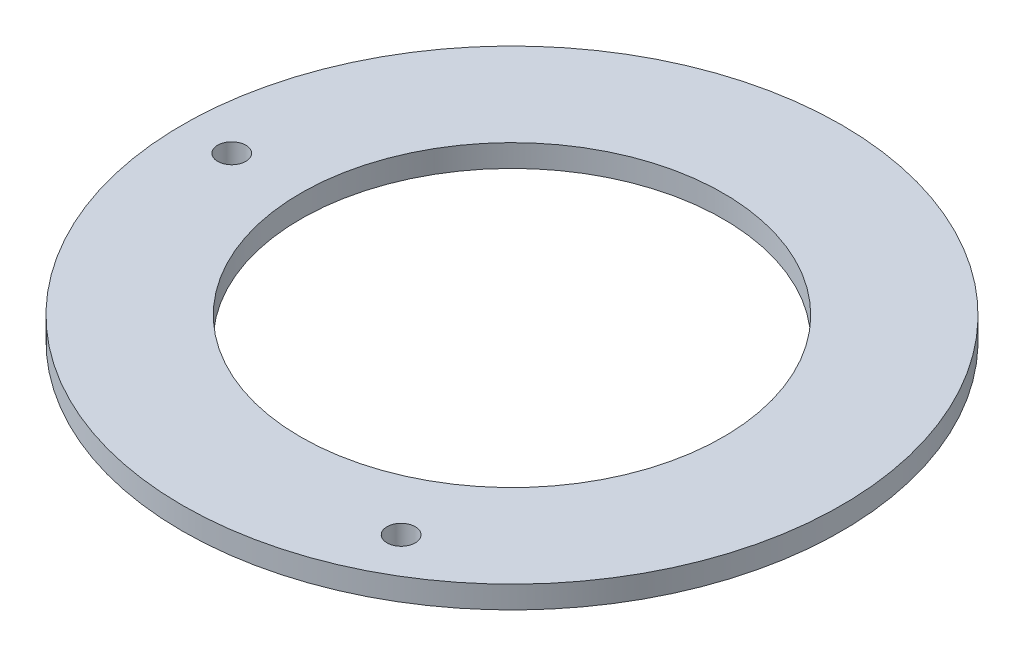
from build123d import *

# Parameters (mm, degrees)
SKETCH1_R           = 46.8
SKETCH1_R_2         = 30
SKETCH1_R_3         = 2
BOSS_EXTRUDE1_DEPTH = 3.175


with BuildPart() as part:
    # Sketch1 → Boss-Extrude1 (new body)
    with BuildSketch(Plane(origin=(0, 0, 0), x_dir=(1, 0, 0), z_dir=(0, 1, 0))):
        with Locations(Location((0, 0, 0), (0, 0, 270))):
            Circle(SKETCH1_R)
        with Locations(Location((0, 0, 0), (0, 0, 270))):
            Circle(SKETCH1_R_2, mode=Mode.SUBTRACT)
        with Locations(Location((-39.8, 0, 0), (0, 0, 270))):
            Circle(SKETCH1_R_3, mode=Mode.SUBTRACT)
        with Locations(Location((19.147864322, -34.891249504, 0), (0, 0, 270))):
            Circle(SKETCH1_R_3, mode=Mode.SUBTRACT)
    extrude(amount=BOSS_EXTRUDE1_DEPTH)


solid = part.part
